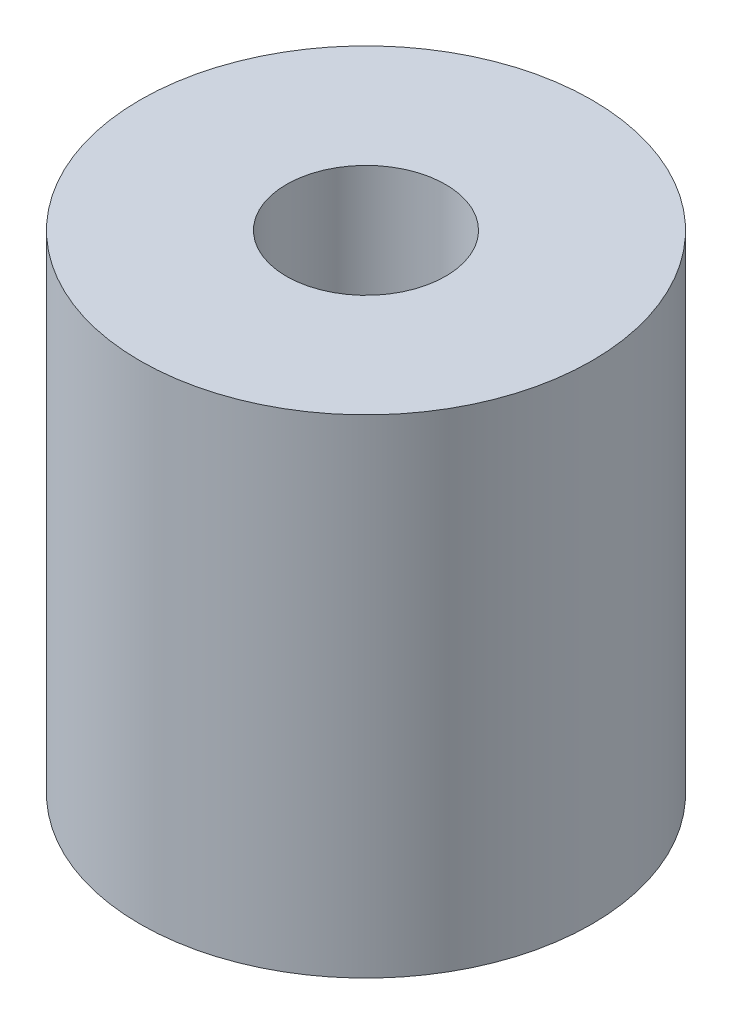
from build123d import *

# Parameters (mm, degrees)
SKETCH1_R           = 4.63195
SKETCH1_R_2         = 1.63195
BOSS_EXTRUDE1_DEPTH = 10


with BuildPart() as part:
    # Sketch1 → Boss-Extrude1 (new body)
    with BuildSketch(Plane(origin=(0, 0, 0), x_dir=(1, 0, 0), z_dir=(0, 1, 0))):
        with Locations(Location((0, 0, 0), (0, 0, 270))):
            Circle(SKETCH1_R)
        with Locations(Location((0, 0, 0), (0, 0, 270))):
            Circle(SKETCH1_R_2, mode=Mode.SUBTRACT)
    extrude(amount=BOSS_EXTRUDE1_DEPTH)


solid = part.part
